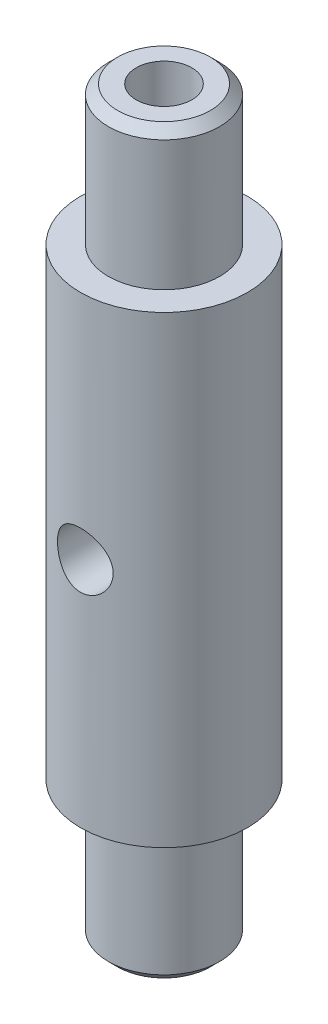
from build123d import *

# Parameters (mm, degrees)
SKETCH2_R                    = 3
CUT_EXTRUDE1_DEPTH           = 46.188494111
CHAMFER1_SIZE                = 1
CHAMFER2_SIZE                = 1
F_6_0_6_DIAMETER_HOLE1_D     = 6
F_6_0_6_DIAMETER_HOLE1_DEPTH = 45
F_6_0_6_DIAMETER_HOLE1_TIP   = 1.802581857


with BuildPart() as part:
    # Sketch1 → Revolve1 (revolve)
    with BuildSketch(Plane.XY, mode=Mode.PRIVATE) as revolve1_sk:
        Polygon((0, 40), (6, 40), (6, 25), (9, 25), (9, -25), (6, -25), (6, -40), (0, -40), align=None)
    revolve(revolve1_sk.sketch.rotate(Axis((0, 40, 0), (0, -1, 0)), 90), axis=Axis((0, 40, 0), (0, -1, 0)))

    # Sketch2 → Cut-Extrude1 (cut, through all)
    with BuildSketch(Plane.XY.offset(10)):
        with Locations(Location((0, 0, 0), (0, 0, 90))):
            Circle(SKETCH2_R)
    extrude(amount=-CUT_EXTRUDE1_DEPTH, mode=Mode.SUBTRACT)

    # Chamfer1
    chamfer1_edges = [part.edges().sort_by_distance(p)[0] for p in [
        (0, -40, -6),
    ]]
    chamfer(chamfer1_edges, length=CHAMFER1_SIZE)

    # Chamfer2
    chamfer2_edges = [part.edges().sort_by_distance(p)[0] for p in [
        (0, 40, -6),
    ]]
    chamfer(chamfer2_edges, length=CHAMFER2_SIZE)

    # Ø6.0 (6) Diameter Hole1
    with Locations(Plane(origin=(0, 40, 0), x_dir=(1, 0, 0), z_dir=(0, 1, 0))):
        with Locations((0, 0)):
            Hole(F_6_0_6_DIAMETER_HOLE1_D / 2, depth=F_6_0_6_DIAMETER_HOLE1_DEPTH)
            with Locations((0, 0, -(F_6_0_6_DIAMETER_HOLE1_DEPTH + F_6_0_6_DIAMETER_HOLE1_TIP / 2))):  # 118° drill point
                Cone(0, F_6_0_6_DIAMETER_HOLE1_D / 2, F_6_0_6_DIAMETER_HOLE1_TIP, mode=Mode.SUBTRACT)


solid = part.part
